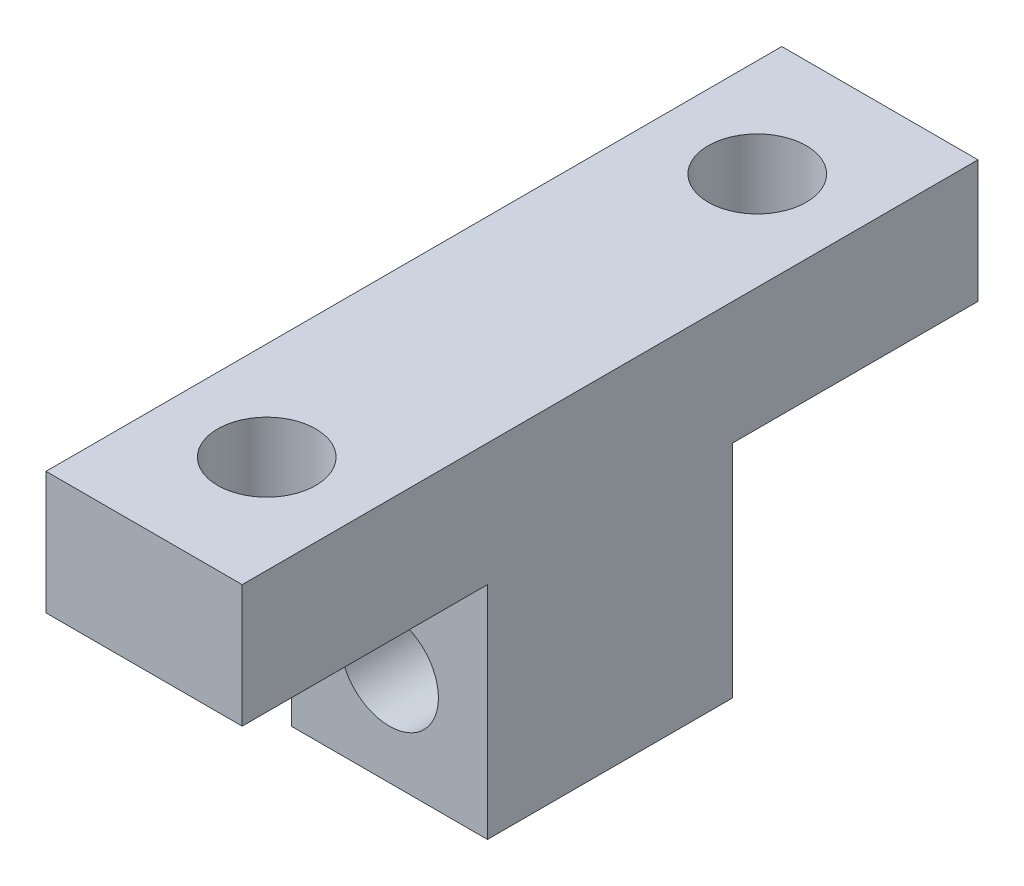
from build123d import *

# Parameters (mm, degrees)
EXTRUDE_1_DEPTH          = 4
CUT_EXTRUDE_1_REACH      = 22.905
SKETCH_2_R               = 2
CUT_EXTRUDE_2_DEPTH      = 21.90454496
CUT_EXTRUDE_2_DEPTH_BACK = 21.90454496
SKETCH_3_R               = 2


with BuildPart() as part:
    # 草图1 → 凸台-拉伸1 (new, symmetric)
    with BuildSketch(Plane(origin=(0, 0, 0), x_dir=(0, 0, -1), z_dir=(1, 0, 0))):
        Polygon((-15, 0), (-15, -5), (-5, -5), (-5, -14), (5, -14), (5, -5), (15, -5), (15, 0), (0, 0), align=None)
    extrude(amount=EXTRUDE_1_DEPTH, both=True)

    # 草图2 → 切除-拉伸1 (cut, up to next)
    with BuildSketch(Plane(origin=(0, 0, 0), x_dir=(1, 0, 0), z_dir=(0, 1, 0)), mode=Mode.PRIVATE) as cut_extrude_1_sk1:
        with Locations(Location((0, 10, 0), (0, 0, 270))):
            Circle(SKETCH_2_R)
    cut_extrude_1_tool1 = extrude(cut_extrude_1_sk1.sketch, amount=-CUT_EXTRUDE_1_REACH, mode=Mode.PRIVATE) & part.part
    # 草图2 → 切除-拉伸1 (cut, up to next)
    with BuildSketch(Plane(origin=(0, 0, 0), x_dir=(1, 0, 0), z_dir=(0, 1, 0)), mode=Mode.PRIVATE) as cut_extrude_1_sk2:
        with Locations(Location((0, -10, 0), (0, 0, 270))):
            Circle(SKETCH_2_R)
    cut_extrude_1_tool2 = extrude(cut_extrude_1_sk2.sketch, amount=-CUT_EXTRUDE_1_REACH, mode=Mode.PRIVATE) & part.part
    add(cut_extrude_1_tool1.solids().sort_by_distance((0, 0, -10))[0], mode=Mode.SUBTRACT)
    add(cut_extrude_1_tool2.solids().sort_by_distance((0, 0, 10))[0], mode=Mode.SUBTRACT)

    # 草图3 → 切除-拉伸2 (cut, two sides: drawn at the far end of the back side and taken through both)
    with BuildSketch(Plane.XY.offset(-CUT_EXTRUDE_2_DEPTH_BACK)):
        with Locations(Location((0, -10, 0), (0, 0, 270))):
            Circle(SKETCH_3_R)
    extrude(amount=CUT_EXTRUDE_2_DEPTH + CUT_EXTRUDE_2_DEPTH_BACK, mode=Mode.SUBTRACT)


solid = part.part
